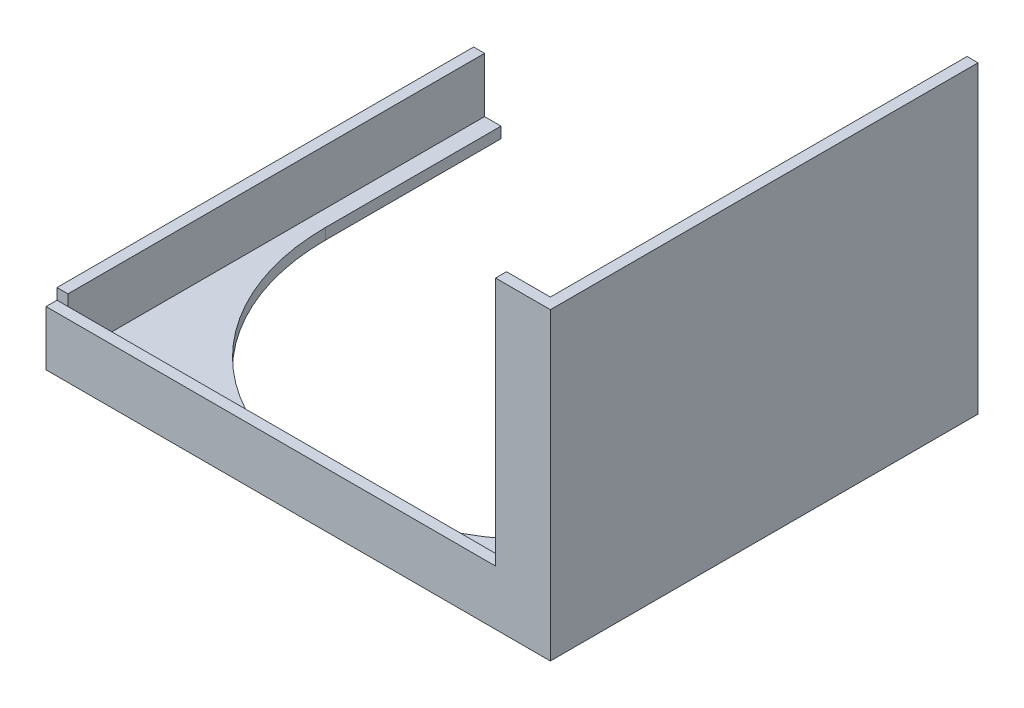
from build123d import *

# Parameters (mm, degrees)
EXTRUDE_1_DEPTH     = 76
EXTRUDE_2_DEPTH     = 2
CUT_EXTRUDE_1_DEPTH = 10
SKETCH_5_W          = 2
SKETCH_5_H          = 76
EXTRUDE_3_DEPTH     = 10


with BuildPart() as part:
    # 草图1 → 凸台-拉伸1 (new body)
    with BuildSketch(Plane.XY):
        Polygon((-92, 0), (0, 0), (0, 55.5), (-2, 55.5), (-2, 2), (-92, 2), align=None)
    extrude(amount=EXTRUDE_1_DEPTH)

    # 草图3 → 凸台-拉伸2 (add)
    with BuildSketch(Plane.XY.offset(76)):
        Polygon((0, 55.5), (-10, 55.5), (-10, 10), (-92, 10), (-92, 0), (0, 0), align=None)
    extrude(amount=EXTRUDE_2_DEPTH)

    # 草图4 → 切除-拉伸1 (cut)
    with BuildSketch(Plane.XZ):
        with BuildLine():
            Line((-87, 0), (-87, 32))
            ThreePointArc((-87, 32), (-46, 73), (-5, 32))
            Line((-5, 32), (-5, 0))
            Line((-5, 0), (-87, 0))
        make_face()
    extrude(amount=-CUT_EXTRUDE_1_DEPTH, mode=Mode.SUBTRACT)

    # 草图5 → 凸台-拉伸3 (add)
    with BuildSketch(Plane(origin=(0, 2, 0), x_dir=(1, 0, 0), z_dir=(0, 1, 0))):
        with Locations((-91, -38)):
            Rectangle(SKETCH_5_W, SKETCH_5_H)
    extrude(amount=EXTRUDE_3_DEPTH)


solid = part.part
